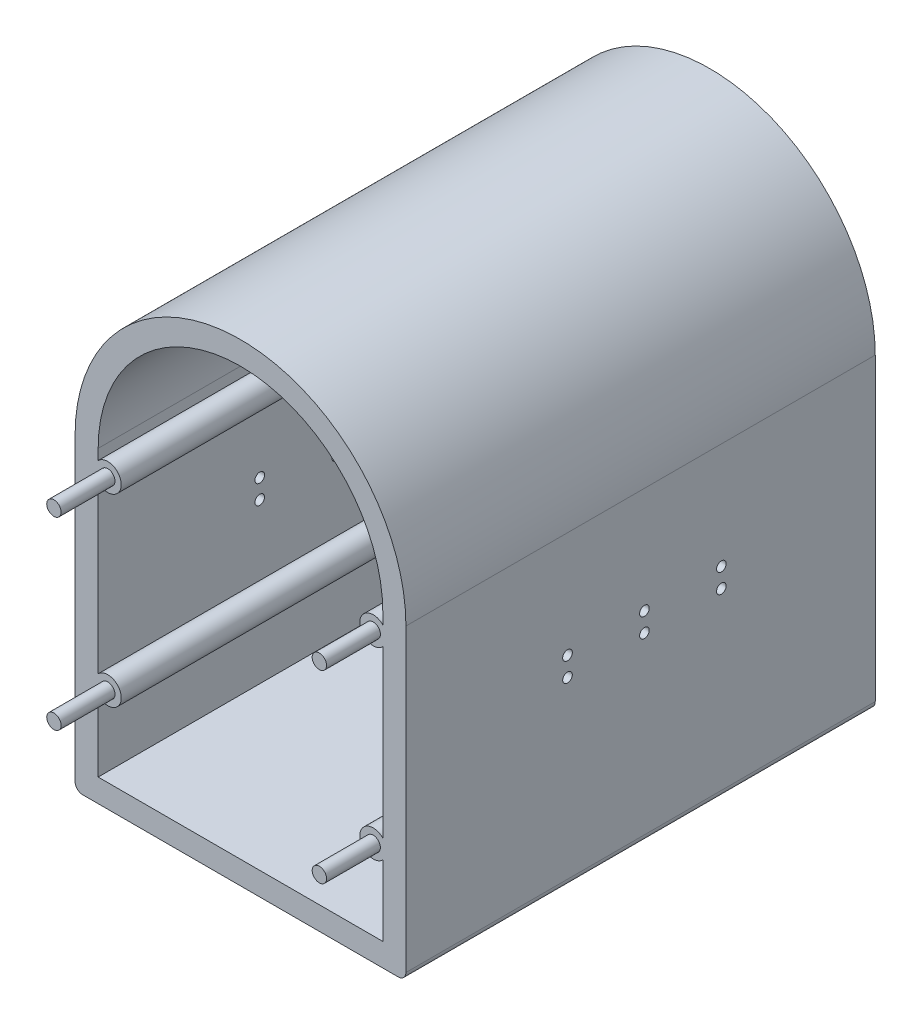
from build123d import *

# Parameters (mm, degrees)
SKETCH2_R           = 1.05
BOSS_EXTRUDE1_DEPTH = 61
BOSS_EXTRUDE2_START = 10
SKETCH2_9_R         = 1.05
BOSS_EXTRUDE2_DEPTH = 58
SKETCH3_R           = 0.625
CUT_EXTRUDE1_DEPTH  = 25
CUT_EXTRUDE2_START  = -25
SKETCH4_R           = 0.625
CUT_EXTRUDE2_DEPTH  = 25
SKETCH5_R           = 0.625
CUT_EXTRUDE3_DEPTH  = 25
CUT_EXTRUDE4_START  = -7
SKETCH6_R           = 1.05
SKETCH6_R_2         = 0.935
CUT_EXTRUDE4_DEPTH  = 7
CUT_EXTRUDE5_START  = -7
SKETCH7_R           = 1.05
SKETCH7_R_2         = 0.935
CUT_EXTRUDE5_DEPTH  = 7
CUT_EXTRUDE6_START  = -7
SKETCH8_R           = 1.05
SKETCH8_R_2         = 0.935
CUT_EXTRUDE6_DEPTH  = 7
CUT_EXTRUDE7_START  = -7
SKETCH9_R           = 1.05
SKETCH9_R_2         = 0.935
CUT_EXTRUDE7_DEPTH  = 7


with BuildPart() as part:
    # Sketch2 → Boss-Extrude1 (new body)
    with BuildSketch(Plane.XY):
        with BuildLine():
            ThreePointArc((21.5, 18.5), (0, 40), (-21.5, 18.5))
            Line((-21.5, 18.5), (-21.5, -20.5))
            ThreePointArc((-21.5, -20.5), (-21.207106781, -21.207106781), (-20.5, -21.5))
            Line((-20.5, -21.5), (20.5, -21.5))
            ThreePointArc((20.5, -21.5), (21.207106781, -21.207106781), (21.5, -20.5))
            Line((21.5, -20.5), (21.5, 18.5))
        make_face()
        with BuildLine():
            Line((18.5, -18.5), (-18.5, -18.5))
            Line((-18.5, -18.5), (-18.5, -9.324744871))
            ThreePointArc((-18.5, -9.324744871), (-15.636648903, -8.77793675), (-17.25, -6.35))
            ThreePointArc((-17.25, -6.35), (-17.92793675, -6.486648903), (-18.5, -6.875255129))
            Line((-18.5, -6.875255129), (-18.5, 14.675255129))
            ThreePointArc((-18.5, 14.675255129), (-17.92793675, 14.286648903), (-17.25, 14.15))
            ThreePointArc((-17.25, 14.15), (-15.636648903, 16.57793675), (-18.5, 17.124744871))
            Line((-18.5, 17.124744871), (-18.5, 18.5))
            ThreePointArc((-18.5, 18.5), (0, 37), (18.5, 18.5))
            Line((18.5, 18.5), (18.5, 17.124744871))
            ThreePointArc((18.5, 17.124744871), (15.636648903, 16.57793675), (17.25, 14.15))
            ThreePointArc((17.25, 14.15), (17.92793675, 14.286648903), (18.5, 14.675255129))
            Line((18.5, 14.675255129), (18.5, -6.875255129))
            ThreePointArc((18.5, -6.875255129), (17.92793675, -6.486648903), (17.25, -6.35))
            ThreePointArc((17.25, -6.35), (15.636648903, -8.77793675), (18.5, -9.324744871))
            Line((18.5, -9.324744871), (18.5, -18.5))
        make_face(mode=Mode.SUBTRACT)
        with Locations((17.25, -8.1)):
            Circle(SKETCH2_R, mode=Mode.SUBTRACT)
        with Locations((17.25, 15.9)):
            Circle(SKETCH2_R, mode=Mode.SUBTRACT)
        with Locations((-17.25, 15.9)):
            Circle(SKETCH2_R, mode=Mode.SUBTRACT)
        with Locations((-17.25, -8.1)):
            Circle(SKETCH2_R, mode=Mode.SUBTRACT)
    extrude(amount=BOSS_EXTRUDE1_DEPTH)

    # Sketch2<9> → Boss-Extrude2 (add)
    with BuildSketch(Plane.XY.offset(BOSS_EXTRUDE2_START)):
        with Locations((-17.25, -8.1)):
            Circle(SKETCH2_9_R)
        with Locations((17.25, -8.1)):
            Circle(SKETCH2_9_R)
        with Locations((-17.25, 15.9)):
            Circle(SKETCH2_9_R)
        with Locations((17.25, 15.9)):
            Circle(SKETCH2_9_R)
    extrude(amount=BOSS_EXTRUDE2_DEPTH)

    # Sketch3 → Cut-Extrude1 (cut)
    with BuildSketch(Plane.ZY.offset(-18.5)):
        with Locations((20, 2.208370448)):
            Circle(SKETCH3_R)
        with Locations((20, 4.708370448)):
            Circle(SKETCH3_R)
        with Locations((30, 2.208370448)):
            Circle(SKETCH3_R)
        with Locations((30, 4.708370448)):
            Circle(SKETCH3_R)
        with Locations((40, 2.208370448)):
            Circle(SKETCH3_R)
        with Locations((40, 4.708370448)):
            Circle(SKETCH3_R)
    extrude(amount=-CUT_EXTRUDE1_DEPTH, mode=Mode.SUBTRACT)

    # Sketch4 → Cut-Extrude2 (cut)
    with BuildSketch(Plane(origin=(-18.5, 0, 0), x_dir=(0, 0, -1), z_dir=(1, 0, 0)).offset(CUT_EXTRUDE2_START)):
        with Locations((-20, 4.708370448)):
            Circle(SKETCH4_R)
        with Locations((-20, 2.208370448)):
            Circle(SKETCH4_R)
        with Locations((-30, 2.208370448)):
            Circle(SKETCH4_R)
        with Locations((-30, 4.708370448)):
            Circle(SKETCH4_R)
        with Locations((-40, 4.708370448)):
            Circle(SKETCH4_R)
        with Locations((-40, 2.208370448)):
            Circle(SKETCH4_R)
    extrude(amount=CUT_EXTRUDE2_DEPTH, mode=Mode.SUBTRACT)

    # Sketch5 → Cut-Extrude3 (cut)
    with BuildSketch(Plane(origin=(0, -18.5, 0), x_dir=(1, 0, 0), z_dir=(0, 1, 0))):
        with Locations((-1.5, -20)):
            Circle(SKETCH5_R)
        with Locations((1, -20)):
            Circle(SKETCH5_R)
        with Locations((-1.5, -30)):
            Circle(SKETCH5_R)
        with Locations((1, -30)):
            Circle(SKETCH5_R)
        with Locations((-1.5, -40)):
            Circle(SKETCH5_R)
        with Locations((1, -40)):
            Circle(SKETCH5_R)
    extrude(amount=-CUT_EXTRUDE3_DEPTH, mode=Mode.SUBTRACT)

    # Sketch6 → Cut-Extrude4 (cut)
    with BuildSketch(Plane.XY.offset(68).offset(CUT_EXTRUDE4_START)):
        with Locations((17.25, 15.9)):
            Circle(SKETCH6_R)
        with Locations((17.25, 15.9)):
            Circle(SKETCH6_R_2, mode=Mode.SUBTRACT)
    extrude(amount=CUT_EXTRUDE4_DEPTH, mode=Mode.SUBTRACT)

    # Sketch7 → Cut-Extrude5 (cut)
    with BuildSketch(Plane.XY.offset(68).offset(CUT_EXTRUDE5_START)):
        with Locations((17.25, -8.1)):
            Circle(SKETCH7_R)
        with Locations((17.25, -8.1)):
            Circle(SKETCH7_R_2, mode=Mode.SUBTRACT)
    extrude(amount=CUT_EXTRUDE5_DEPTH, mode=Mode.SUBTRACT)

    # Sketch8 → Cut-Extrude6 (cut)
    with BuildSketch(Plane.XY.offset(68).offset(CUT_EXTRUDE6_START)):
        with Locations((-17.25, -8.1)):
            Circle(SKETCH8_R)
        with Locations((-17.25, -8.1)):
            Circle(SKETCH8_R_2, mode=Mode.SUBTRACT)
    extrude(amount=CUT_EXTRUDE6_DEPTH, mode=Mode.SUBTRACT)

    # Sketch9 → Cut-Extrude7 (cut)
    with BuildSketch(Plane.XY.offset(68).offset(CUT_EXTRUDE7_START)):
        with Locations((-17.25, 15.9)):
            Circle(SKETCH9_R)
        with Locations((-17.25, 15.9)):
            Circle(SKETCH9_R_2, mode=Mode.SUBTRACT)
    extrude(amount=CUT_EXTRUDE7_DEPTH, mode=Mode.SUBTRACT)


solid = part.part
